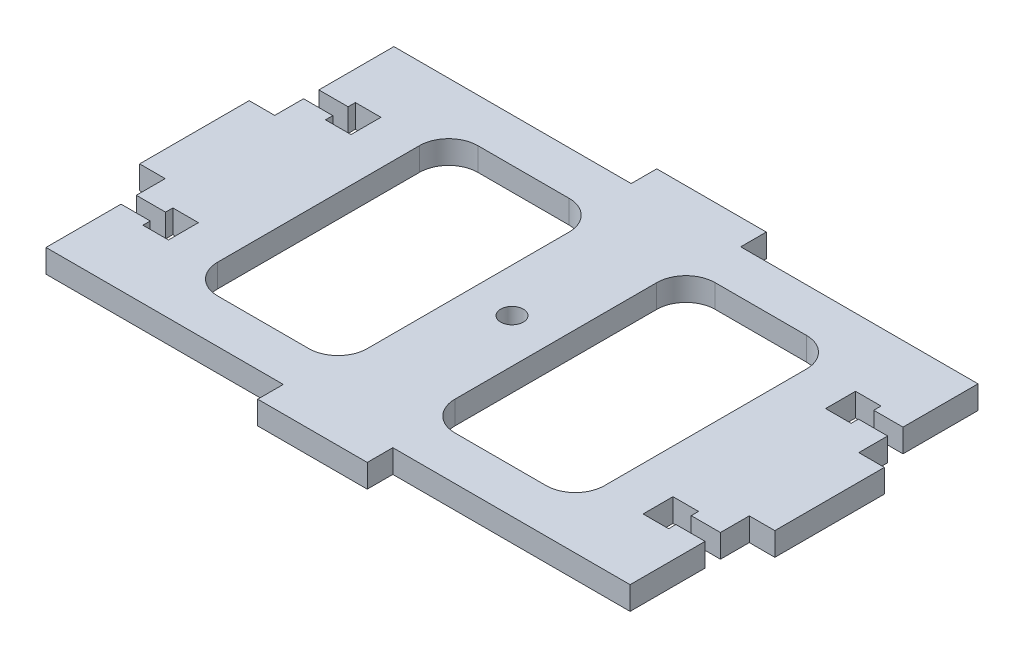
from build123d import *

# Parameters (mm, degrees)
SKETCH2_W               = 80
SKETCH2_H               = 47.65
BOSS_EXTRUDE1_DEPTH     = 3.175
SKETCH3_W               = 15
SKETCH3_H               = 3.5
BOSS_EXTRUDE2_DEPTH     = 3.175
SKETCH4_W               = 3.5
SKETCH4_H               = 15
BOSS_EXTRUDE3_DEPTH     = 3.175
MIRROR2_COPY_1_SKETCH_W = 3.5
MIRROR2_COPY_1_SKETCH_H = 15
MIRROR2_COPY_1_DEPTH    = 3.175
MIRROR2_COPY_2_SKETCH_W = 3.5
MIRROR2_COPY_2_SKETCH_H = 15
MIRROR2_COPY_2_DEPTH    = 3.175
CUT_EXTRUDE1_DEPTH      = 10
MIRROR4_COPY_1_DEPTH    = 10
CUT_EXTRUDE6_DEPTH      = 52.468303353
CUT_EXTRUDE6_DEPTH_BACK = 52.468303353
SKETCH7_R               = 1.55
CUT_EXTRUDE7_DEPTH      = 52.468303353
CUT_EXTRUDE7_DEPTH_BACK = 52.468303353


with BuildPart() as part:
    # Sketch2 → Boss-Extrude1 (new body)
    with BuildSketch(Plane(origin=(0, 0, 0), x_dir=(1, 0, 0), z_dir=(0, 1, 0))):
        Rectangle(SKETCH2_W, SKETCH2_H)
    extrude(amount=BOSS_EXTRUDE1_DEPTH)

    # Sketch3 → Boss-Extrude2 (add)
    with BuildSketch(Plane(origin=(0, 3.175, 0), x_dir=(1, 0, 0), z_dir=(0, 1, 0))):
        with Locations((0, 25.575)):
            Rectangle(SKETCH3_W, SKETCH3_H)
    boss_extrude2 = extrude(amount=-BOSS_EXTRUDE2_DEPTH)

    # Sketch4 → Boss-Extrude3 (add)
    with BuildSketch(Plane(origin=(0, 3.175, 0), x_dir=(1, 0, 0), z_dir=(0, 1, 0))):
        with Locations((-41.75, 0)):
            Rectangle(SKETCH4_W, SKETCH4_H)
    boss_extrude3 = extrude(amount=-BOSS_EXTRUDE3_DEPTH)

    # Mirror1: Boss-Extrude3 across plane
    add(boss_extrude3.mirror(Plane(origin=(0, 0, 0), x_dir=(0, 0, 1), z_dir=(1, 0, 0))))

    # Mirror2: Boss-Extrude2 across plane
    add(boss_extrude2.mirror(Plane.XY))

    # Mirror2 copy 1 sketch → Mirror2 copy 1 (add)
    with BuildSketch(Plane(origin=(0, 3.175, 0), x_dir=(-1, 0, 0), z_dir=(0, 1, 0))):
        with Locations((-41.75, 0)):
            Rectangle(MIRROR2_COPY_1_SKETCH_W, MIRROR2_COPY_1_SKETCH_H)
    extrude(amount=-MIRROR2_COPY_1_DEPTH)

    # Mirror2 copy 2 sketch → Mirror2 copy 2 (add)
    with BuildSketch(Plane(origin=(0, 3.175, 0), x_dir=(1, 0, 0), z_dir=(0, 1, 0))):
        with Locations((-41.75, 0)):
            Rectangle(MIRROR2_COPY_2_SKETCH_W, MIRROR2_COPY_2_SKETCH_H)
    extrude(amount=-MIRROR2_COPY_2_DEPTH)

    # Sketch5 → Cut-Extrude1 (cut)
    with BuildSketch(Plane(origin=(0, 3.175, 0), x_dir=(1, 0, 0), z_dir=(0, 1, 0))):
        Polygon((-40, 13.55), (-36, 13.55), (-36, 14.55), (-32.5, 14.55), (-32.5, 10.45), (-36, 10.45), (-36, 11.45), (-40, 11.45), align=None)
    cut_extrude1 = extrude(amount=-CUT_EXTRUDE1_DEPTH, mode=Mode.SUBTRACT)

    # Mirror3: Cut-Extrude1 across plane
    add(cut_extrude1.mirror(Plane.XY), mode=Mode.SUBTRACT)

    # Mirror4: Cut-Extrude1 across plane
    add(cut_extrude1.mirror(Plane(origin=(0, 0, 0), x_dir=(0, 0, 1), z_dir=(1, 0, 0))), mode=Mode.SUBTRACT)

    # Mirror4 copy 1 sketch → Mirror4 copy 1 (cut)
    with BuildSketch(Plane(origin=(0, 3.175, 0), x_dir=(-1, 0, 0), z_dir=(0, 1, 0))):
        Polygon((-40, 13.55), (-36, 13.55), (-36, 14.55), (-32.5, 14.55), (-32.5, 10.45), (-36, 10.45), (-36, 11.45), (-40, 11.45), align=None)
    extrude(amount=-MIRROR4_COPY_1_DEPTH, mode=Mode.SUBTRACT)

    # Sketch7 → Cut-Extrude6 (cut, two sides: drawn at the far end of the back side and taken through both)
    with BuildSketch(Plane(origin=(0, 0, 0), x_dir=(1, 0, 0), z_dir=(0, 1, 0)).offset(-CUT_EXTRUDE6_DEPTH_BACK)):
        with Locations(Location((0, 0, 0), (0, 0, 270))):
            Circle(SKETCH7_R)
    extrude(amount=CUT_EXTRUDE6_DEPTH + CUT_EXTRUDE6_DEPTH_BACK, mode=Mode.SUBTRACT)

    # Sketch8 → Cut-Extrude7 (cut, two sides: drawn at the far end of the back side and taken through both)
    with BuildSketch(Plane(origin=(0, 3.175, 0), x_dir=(1, 0, 0), z_dir=(0, 1, 0)).offset(-CUT_EXTRUDE7_DEPTH_BACK)):
        with BuildLine():
            Line((-22.5, 17.825), (-10, 17.825))
            ThreePointArc((-10, 17.825), (-7.171572875, 16.653427125), (-6, 13.825))
            Line((-6, 13.825), (-6, -13.825))
            ThreePointArc((-6, -13.825), (-7.171572875, -16.653427125), (-10, -17.825))
            Line((-10, -17.825), (-22.5, -17.825))
            ThreePointArc((-22.5, -17.825), (-25.328427125, -16.653427125), (-26.5, -13.825))
            Line((-26.5, -13.825), (-26.5, 13.825))
            ThreePointArc((-26.5, 13.825), (-25.328427125, 16.653427125), (-22.5, 17.825))
        make_face()
        with BuildLine():
            Line((22.5, -17.825), (10, -17.825))
            ThreePointArc((10, -17.825), (7.171572875, -16.653427125), (6, -13.825))
            Line((6, -13.825), (6, 13.825))
            ThreePointArc((6, 13.825), (7.171572875, 16.653427125), (10, 17.825))
            Line((10, 17.825), (22.5, 17.825))
            ThreePointArc((22.5, 17.825), (25.328427125, 16.653427125), (26.5, 13.825))
            Line((26.5, 13.825), (26.5, -13.825))
            ThreePointArc((26.5, -13.825), (25.328427125, -16.653427125), (22.5, -17.825))
        make_face()
    extrude(amount=CUT_EXTRUDE7_DEPTH + CUT_EXTRUDE7_DEPTH_BACK, mode=Mode.SUBTRACT)


solid = part.part
